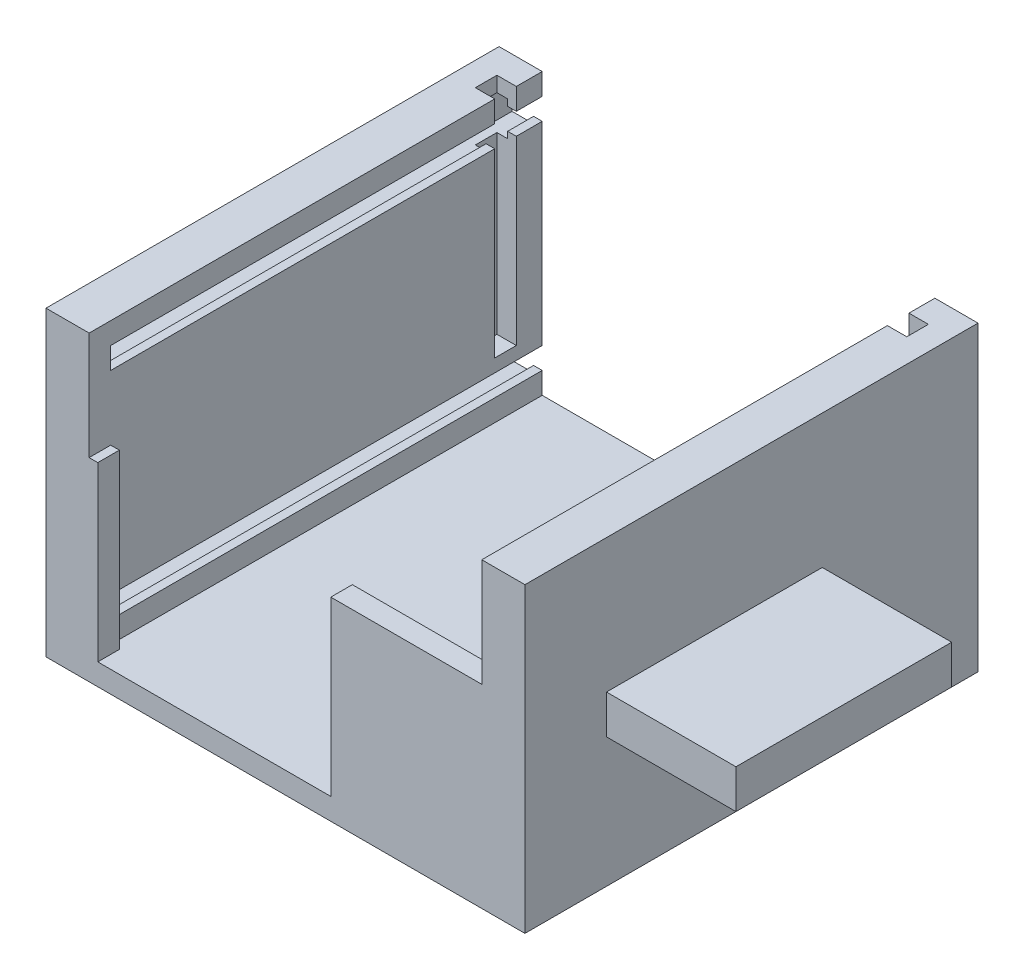
from build123d import *

# Parameters (mm, degrees)
BOSS_EXTRUDE1_DEPTH = 50
CUT_EXTRUDE3_DEPTH  = 120.604556769
BOSS_EXTRUDE2_DEPTH = 5
CUT_EXTRUDE4_START  = 35
SKETCH4_W           = 100
SKETCH4_H           = 5
CUT_EXTRUDE4_DEPTH  = 52
SKETCH5_W           = 50
SKETCH5_H           = 9
BOSS_EXTRUDE3_DEPTH = 30


with BuildPart() as part:
    # Sketch1 → Boss-Extrude1 (new, symmetric)
    with BuildSketch(Plane.XY):
        Polygon((-45.5, 30), (-45.5, 35), (-55.5, 35), (-55.5, -35), (55.5, -35), (55.5, 35), (45.5, 35), (45.5, 30), (45.5, -30), (-45.5, -30), align=None)
    extrude(amount=BOSS_EXTRUDE1_DEPTH, both=True)

    # Sketch2 → Cut-Extrude3 (cut, through all)
    with BuildSketch(Plane.XY.offset(50)):
        Polygon((-47.5, 25), (-45.5, 25), (-45.5, 30), (-47.5, 30), (-47.5, 31.5), (-52.5, 31.5), (-52.5, 23.5), (-47.5, 23.5), align=None)
        Polygon((47.5, 23.5), (47.5, 25), (45.5, 25), (45.5, 30), (47.5, 30), (47.5, 31.5), (52.5, 31.5), (52.5, 23.5), align=None)
        Polygon((47.5, -20), (45.5, -20), (45.5, -25), (47.5, -25), (47.5, -26.5), (52.5, -26.5), (52.5, -18.5), (47.5, -18.5), align=None)
        Polygon((-47.5, -18.5), (-47.5, -20), (-45.5, -20), (-45.5, -25), (-47.5, -25), (-47.5, -26.5), (-52.5, -26.5), (-52.5, -18.5), align=None)
    extrude(amount=-CUT_EXTRUDE3_DEPTH, mode=Mode.SUBTRACT)

    # Sketch3 → Boss-Extrude2 (add)
    with BuildSketch(Plane.XY.offset(50)):
        Polygon((10.5, 10), (10.5, -30), (45.5, -30), (45.5, -25), (45.5, -20), (45.5, 10), align=None)
        Polygon((-45.5, 35), (-55.5, 35), (-55.5, -35), (55.5, -35), (55.5, 35), (45.5, 35), (45.5, 30), (47.5, 30), (47.5, 31.5), (52.5, 31.5), (52.5, 23.5), (47.5, 23.5), (47.5, 25), (45.5, 25), (45.5, 10), (45.5, -20), (47.5, -20), (47.5, -18.5), (52.5, -18.5), (52.5, -26.5), (47.5, -26.5), (47.5, -25), (45.5, -25), (45.5, -30), (10.5, -30), (-43.5, -30), (-45.5, -30), (-45.5, -25), (-47.5, -25), (-47.5, -26.5), (-52.5, -26.5), (-52.5, -18.5), (-47.5, -18.5), (-47.5, -20), (-45.5, -20), (-45.5, 10), (-45.5, 25), (-47.5, 25), (-47.5, 23.5), (-52.5, 23.5), (-52.5, 31.5), (-47.5, 31.5), (-47.5, 30), (-45.5, 30), align=None)
        Polygon((-43.5, 10), (-45.5, 10), (-45.5, -20), (-45.5, -25), (-45.5, -30), (-43.5, -30), align=None)
        Polygon((47.5, -20), (45.5, -20), (45.5, -25), (47.5, -25), (47.5, -26.5), (52.5, -26.5), (52.5, -18.5), (47.5, -18.5), align=None)
        Polygon((47.5, 30), (45.5, 30), (45.5, 25), (47.5, 25), (47.5, 23.5), (52.5, 23.5), (52.5, 31.5), (47.5, 31.5), align=None)
        Polygon((-45.5, -25), (-45.5, -20), (-47.5, -20), (-47.5, -18.5), (-52.5, -18.5), (-52.5, -26.5), (-47.5, -26.5), (-47.5, -25), align=None)
        Polygon((-45.5, 25), (-45.5, 30), (-47.5, 30), (-47.5, 31.5), (-52.5, 31.5), (-52.5, 23.5), (-47.5, 23.5), (-47.5, 25), align=None)
    extrude(amount=BOSS_EXTRUDE2_DEPTH)

    # Sketch4 → Cut-Extrude4 (cut)
    with BuildSketch(Plane(origin=(0, 0, 0), x_dir=(1, 0, 0), z_dir=(0, 1, 0)).offset(CUT_EXTRUDE4_START)):
        with Locations((0, 41.5)):
            Rectangle(SKETCH4_W, SKETCH4_H)
    extrude(amount=-CUT_EXTRUDE4_DEPTH, mode=Mode.SUBTRACT)

    # Sketch5 → Boss-Extrude3 (add)
    with BuildSketch(Plane(origin=(55.5, 0, 0), x_dir=(0, 0, -1), z_dir=(1, 0, 0))):
        with Locations((-11.097410489, -0.5)):
            Rectangle(SKETCH5_W, SKETCH5_H)
    extrude(amount=BOSS_EXTRUDE3_DEPTH)


solid = part.part
